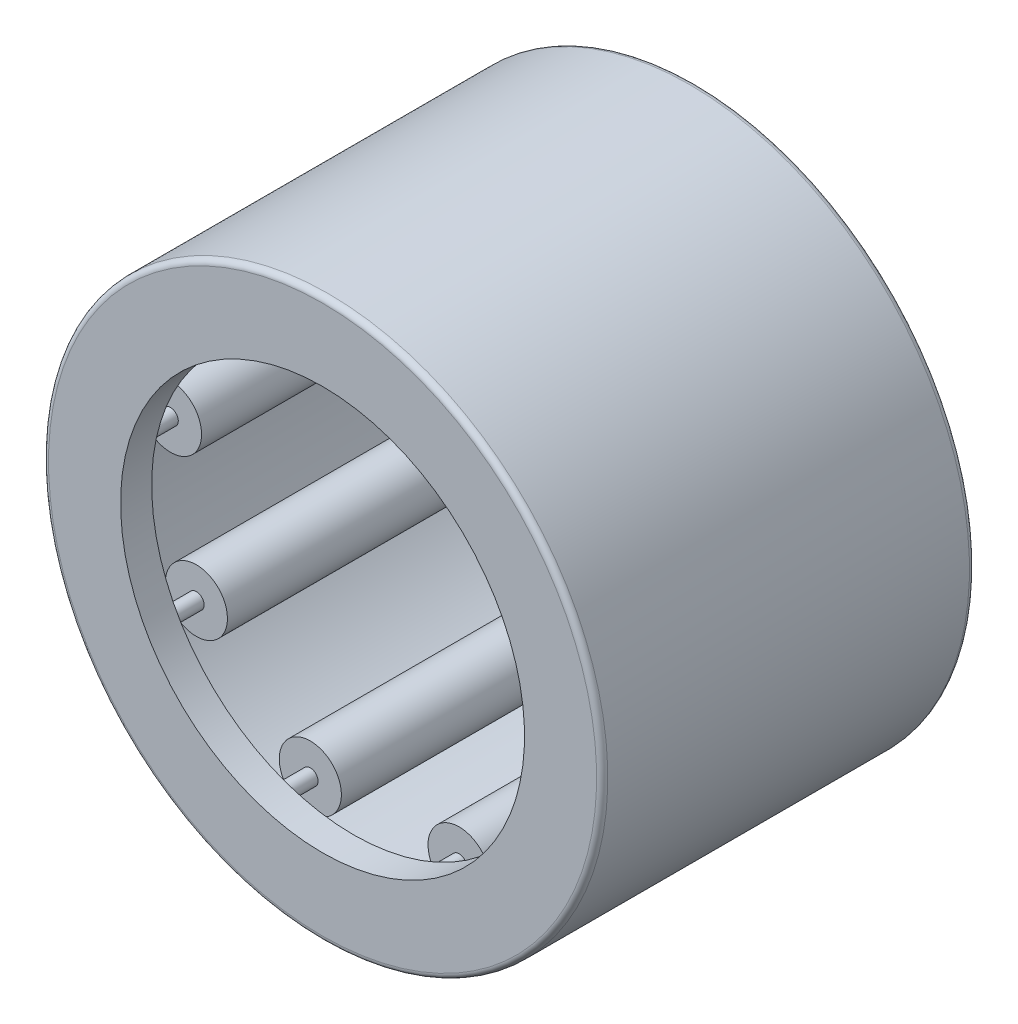
from build123d import *

# Parameters (mm, degrees)
SKETCH2_W         = 6.35
SKETCH2_H         = 0.5953125
SKETCH3_W         = 7.9375
SKETCH3_H         = 0.1984375
CIRPATTERN1_COUNT = 9
CIRPATTERN1_ANGLE = 320
FILLET1_R         = 0.142875


with BuildPart() as part:
    # Sketch1 → Revolve1 (revolve)
    with BuildSketch(Plane(origin=(0, 0, 0), x_dir=(0, 0, -1), z_dir=(1, 0, 0))):
        Polygon((-4.7625, 7.14375), (4.7625, 7.14375), (4.7625, 5.159375), (3.96875, 5.159375), (3.96875, 6.35), (-3.96875, 6.35), (-3.96875, 5.159375), (-4.7625, 5.159375), align=None)
    revolve(axis=Axis((0, 0, 4.7625), (0, 0, -1)))

    # Fillet1
    fillet1_edges = [part.edges().sort_by_distance(p)[0] for p in [
        (0, -7.14375, -4.7625),
        (0, -7.14375, 4.7625),
    ]]
    fillet(fillet1_edges, radius=FILLET1_R)


with BuildPart() as body_2:
    # Sketch2 → Revolve2 (revolve)
    with BuildSketch(Plane(origin=(0, 0, 0), x_dir=(0, 0, -1), z_dir=(1, 0, 0))):
        with Locations((0, 6.05234375)):
            Rectangle(SKETCH2_W, SKETCH2_H)
    revolve(axis=Axis((0, 5.55625, 3.175), (0, 0, -1)))


with BuildPart() as body_3:
    # Sketch3 → Revolve3 (revolve)
    with BuildSketch(Plane(origin=(0, 0, 0), x_dir=(0, 0, -1), z_dir=(1, 0, 0))):
        with Locations((0, 5.65546875)):
            Rectangle(SKETCH3_W, SKETCH3_H)
    revolve(axis=Axis((0, 5.55625, 3.96875), (0, 0, -1)))


with BuildPart() as cirpattern1_1:
    # CirPattern1: pattern copy
    add(body_2.part.rotate(Axis((0, 0, -4.7625), (0, 0, 1)), 1 * CIRPATTERN1_ANGLE / (CIRPATTERN1_COUNT - 1)))


with BuildPart() as cirpattern1_2:
    # CirPattern1: pattern copy
    add(body_2.part.rotate(Axis((0, 0, -4.7625), (0, 0, 1)), 2 * CIRPATTERN1_ANGLE / (CIRPATTERN1_COUNT - 1)))


with BuildPart() as cirpattern1_3:
    # CirPattern1: pattern copy
    add(body_2.part.rotate(Axis((0, 0, -4.7625), (0, 0, 1)), 3 * CIRPATTERN1_ANGLE / (CIRPATTERN1_COUNT - 1)))


with BuildPart() as cirpattern1_4:
    # CirPattern1: pattern copy
    add(body_2.part.rotate(Axis((0, 0, -4.7625), (0, 0, 1)), 4 * CIRPATTERN1_ANGLE / (CIRPATTERN1_COUNT - 1)))


with BuildPart() as cirpattern1_5:
    # CirPattern1: pattern copy
    add(body_2.part.rotate(Axis((0, 0, -4.7625), (0, 0, 1)), 5 * CIRPATTERN1_ANGLE / (CIRPATTERN1_COUNT - 1)))


with BuildPart() as cirpattern1_6:
    # CirPattern1: pattern copy
    add(body_2.part.rotate(Axis((0, 0, -4.7625), (0, 0, 1)), 6 * CIRPATTERN1_ANGLE / (CIRPATTERN1_COUNT - 1)))


with BuildPart() as cirpattern1_7:
    # CirPattern1: pattern copy
    add(body_2.part.rotate(Axis((0, 0, -4.7625), (0, 0, 1)), 7 * CIRPATTERN1_ANGLE / (CIRPATTERN1_COUNT - 1)))


with BuildPart() as cirpattern1_8:
    # CirPattern1: pattern copy
    add(body_2.part.rotate(Axis((0, 0, -4.7625), (0, 0, 1)), 8 * CIRPATTERN1_ANGLE / (CIRPATTERN1_COUNT - 1)))


with BuildPart() as cirpattern1_9:
    # CirPattern1: pattern copy
    add(body_3.part.rotate(Axis((0, 0, -4.7625), (0, 0, 1)), 1 * CIRPATTERN1_ANGLE / (CIRPATTERN1_COUNT - 1)))


with BuildPart() as cirpattern1_10:
    # CirPattern1: pattern copy
    add(body_3.part.rotate(Axis((0, 0, -4.7625), (0, 0, 1)), 2 * CIRPATTERN1_ANGLE / (CIRPATTERN1_COUNT - 1)))


with BuildPart() as cirpattern1_11:
    # CirPattern1: pattern copy
    add(body_3.part.rotate(Axis((0, 0, -4.7625), (0, 0, 1)), 3 * CIRPATTERN1_ANGLE / (CIRPATTERN1_COUNT - 1)))


with BuildPart() as cirpattern1_12:
    # CirPattern1: pattern copy
    add(body_3.part.rotate(Axis((0, 0, -4.7625), (0, 0, 1)), 4 * CIRPATTERN1_ANGLE / (CIRPATTERN1_COUNT - 1)))


with BuildPart() as cirpattern1_13:
    # CirPattern1: pattern copy
    add(body_3.part.rotate(Axis((0, 0, -4.7625), (0, 0, 1)), 5 * CIRPATTERN1_ANGLE / (CIRPATTERN1_COUNT - 1)))


with BuildPart() as cirpattern1_14:
    # CirPattern1: pattern copy
    add(body_3.part.rotate(Axis((0, 0, -4.7625), (0, 0, 1)), 6 * CIRPATTERN1_ANGLE / (CIRPATTERN1_COUNT - 1)))


with BuildPart() as cirpattern1_15:
    # CirPattern1: pattern copy
    add(body_3.part.rotate(Axis((0, 0, -4.7625), (0, 0, 1)), 7 * CIRPATTERN1_ANGLE / (CIRPATTERN1_COUNT - 1)))


with BuildPart() as cirpattern1_16:
    # CirPattern1: pattern copy
    add(body_3.part.rotate(Axis((0, 0, -4.7625), (0, 0, 1)), 8 * CIRPATTERN1_ANGLE / (CIRPATTERN1_COUNT - 1)))


solid = Compound([part.part, body_2.part, body_3.part, cirpattern1_1.part, cirpattern1_2.part, cirpattern1_3.part, cirpattern1_4.part, cirpattern1_5.part, cirpattern1_6.part, cirpattern1_7.part, cirpattern1_8.part, cirpattern1_9.part, cirpattern1_10.part, cirpattern1_11.part, cirpattern1_12.part, cirpattern1_13.part, cirpattern1_14.part, cirpattern1_15.part, cirpattern1_16.part])
